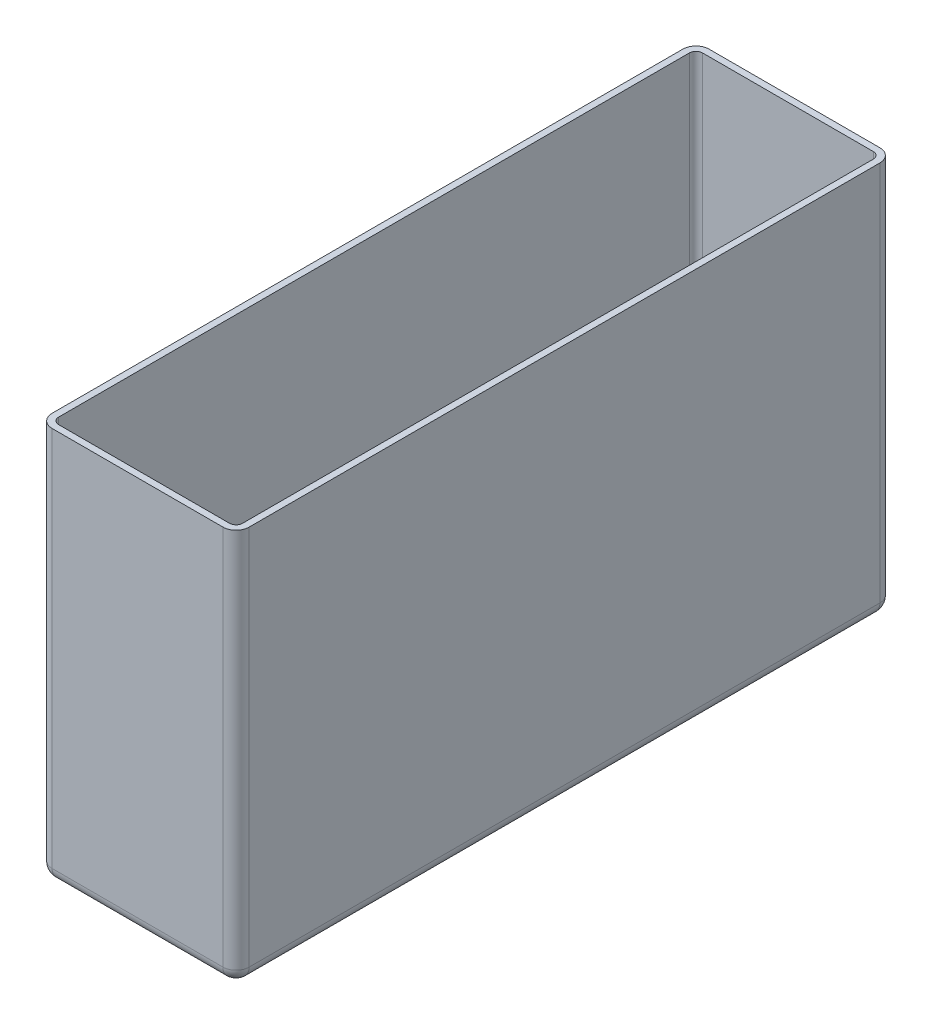
from build123d import *

# Parameters (mm, degrees)
CROQUIS1_W     = 150
CROQUIS1_H     = 500
EXTRUIR1_DEPTH = 300
REDONDEO1_R    = 10
VACIADO1_T     = -5


with BuildPart() as part:
    # Croquis1 → Extruir1 (new body)
    with BuildSketch(Plane(origin=(0, 0, 0), x_dir=(1, 0, 0), z_dir=(0, 1, 0))):
        Rectangle(CROQUIS1_W, CROQUIS1_H)
    extrude(amount=EXTRUIR1_DEPTH)

    # Redondeo1
    redondeo1_edges = [part.edges().sort_by_distance(p)[0] for p in [
        (0, 0, -250),
        (75, 0, 0),
        (0, 0, 250),
        (-75, 0, 0),
        (-75, 150, -250),
        (75, 150, -250),
        (75, 150, 250),
        (-75, 150, 250),
    ]]
    fillet(redondeo1_edges, radius=REDONDEO1_R)

    # Vaciado1
    vaciado1_openings = [part.faces().sort_by_distance(p)[0] for p in [
        (0, 300, 0),
    ]]
    offset(amount=VACIADO1_T, openings=vaciado1_openings, kind=Kind.INTERSECTION)


solid = part.part
